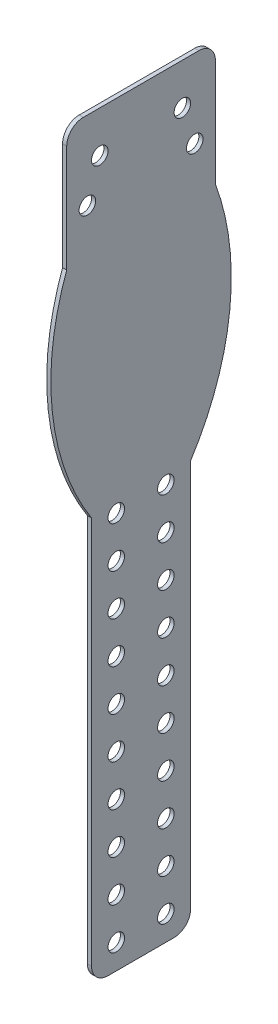
from build123d import *

# Parameters (mm, degrees)
BOSS_EXTRUDE1_DEPTH      = 1
F_4_0_4_DIAMETER_HOLE3_D = 4
F_4_0_4_DIAMETER_HOLE2_D = 4
F_4_0_4_DIAMETER_HOLE1_D = 4
LPATTERN1_COUNT          = 10
LPATTERN1_PITCH          = 10
FILLET1_R                = 4


with BuildPart() as part:
    # Sketch1 → Boss-Extrude1 (new body)
    with BuildSketch(Plane(origin=(0, 0, 0), x_dir=(0, 0, -1), z_dir=(1, 0, 0))):
        with BuildLine():
            Line((12, -183), (12, -85))
            ThreePointArc((12, -85), (21.475099597, -58.206374501), (18, -30))
            Line((18, -30), (18, 0))
            Line((18, 0), (-18, 0))
            Line((-18, 0), (-18, -30))
            ThreePointArc((-18, -30), (-21.475099597, -58.206374501), (-12, -85))
            Line((-12, -85), (-12, -183))
            Line((-12, -183), (12, -183))
        make_face()
    extrude(amount=BOSS_EXTRUDE1_DEPTH)

    # Ø4.0 (4) Diameter Hole3 (through all)
    with Locations(Plane.ZY):
        with Locations((10, -10), (-10, -10)):
            Hole(F_4_0_4_DIAMETER_HOLE3_D / 2)

    # Ø4.0 (4) Diameter Hole2 (through all)
    with Locations(Plane.ZY):
        with Locations((-13, -19), (13, -19)):
            Hole(F_4_0_4_DIAMETER_HOLE2_D / 2)

    # Ø4.0 (4) Diameter Hole1 (through all)
    with Locations(Plane(origin=(1, 0, 0), x_dir=(0, 0, -1), z_dir=(1, 0, 0))):
        with Locations((-6, -177), (6, -177)):
            f_4_0_4_diameter_hole1 = Hole(F_4_0_4_DIAMETER_HOLE1_D / 2)

    # LPattern1: Ø4.0 (4) Diameter Hole1 ×10
    with Locations(*[(0, i * LPATTERN1_PITCH, 0) for i in range(1, LPATTERN1_COUNT)]):
        add(f_4_0_4_diameter_hole1, mode=Mode.SUBTRACT)

    # Fillet1
    fillet1_edges = [part.edges().sort_by_distance(p)[0] for p in [
        (0.5, 0, 18),
        (0.5, 0, -18),
        (0.5, -183, -12),
        (0.5, -183, 12),
    ]]
    fillet(fillet1_edges, radius=FILLET1_R)


solid = part.part
